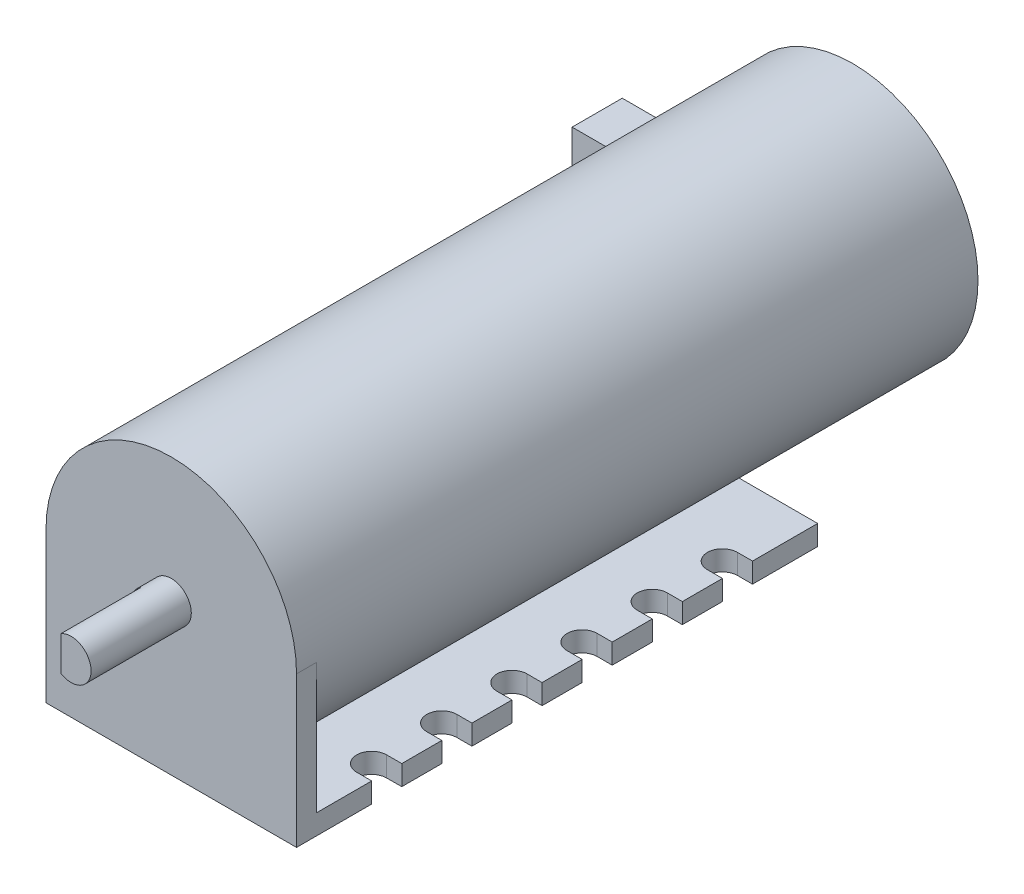
from build123d import *

# Parameters (mm, degrees)
SKETCH1_R           = 12.5
BOSS_EXTRUDE1_DEPTH = 68
SKETCH3_R           = 2
BOSS_EXTRUDE3_DEPTH = 2
BOSS_EXTRUDE2_DEPTH = 8
BOSS_EXTRUDE4_DEPTH = 2
SKETCH5_W           = 25
SKETCH5_H           = 2
BOSS_EXTRUDE5_DEPTH = 50
SKETCH6_R           = 1.5
CUT_EXTRUDE1_DEPTH  = 2
SKETCH7_W           = 5
SKETCH7_H           = 12
BOSS_EXTRUDE6_DEPTH = 15


with BuildPart() as part:
    # Sketch1 → Boss-Extrude1 (new body)
    with BuildSketch(Plane.XY):
        Circle(SKETCH1_R)
    extrude(amount=-BOSS_EXTRUDE1_DEPTH)

    # Sketch3 → Boss-Extrude3 (add)
    with BuildSketch(Plane.XY):
        Circle(SKETCH3_R)
    extrude(amount=BOSS_EXTRUDE3_DEPTH)

    # Sketch2 → Boss-Extrude2 (add)
    with BuildSketch(Plane.XY.offset(2)):
        with BuildLine():
            Line((-1, 1.732050808), (-1, -1.732050808))
            ThreePointArc((-1, -1.732050808), (2, 0), (-1, 1.732050808))
        make_face()
    extrude(amount=BOSS_EXTRUDE2_DEPTH)

    # Sketch4 → Boss-Extrude4 (add)
    with BuildSketch(Plane.XY):
        with BuildLine():
            Line((-12.5, 0), (-12.5, -15))
            Line((-12.5, -15), (12.5, -15))
            Line((12.5, -15), (12.5, 0))
            ThreePointArc((12.5, 0), (0, -12.5), (-12.5, 0))
        make_face()
    extrude(amount=-BOSS_EXTRUDE4_DEPTH)

    # Sketch5 → Boss-Extrude5 (add)
    with BuildSketch(Plane(origin=(0, 0, -2), x_dir=(-1, 0, 0), z_dir=(0, 0, -1))):
        with Locations((0, -14)):
            Rectangle(SKETCH5_W, SKETCH5_H)
    extrude(amount=BOSS_EXTRUDE5_DEPTH)

    # Sketch6 → Cut-Extrude1 (cut)
    with BuildSketch(Plane.XZ.offset(15)):
        with Locations(Location((0, -6, 0), (0, 0, 270))):
            Circle(SKETCH6_R)
        with Locations(Location((0, -12.5, 0), (0, 0, 270))):
            Circle(SKETCH6_R)
        with Locations(Location((0, -19, 0), (0, 0, 270))):
            Circle(SKETCH6_R)
        with Locations(Location((0, -25.5, 0), (0, 0, 270))):
            Circle(SKETCH6_R)
        with Locations(Location((0, -32, 0), (0, 0, 270))):
            Circle(SKETCH6_R)
        with Locations(Location((0, -38.5, 0), (0, 0, 270))):
            Circle(SKETCH6_R)
        with Locations(Location((0, -45, 0), (0, 0, 270))):
            Circle(SKETCH6_R)
        with BuildLine():
            Line((-11, -7.5), (-12.5, -7.5))
            Line((-12.5, -7.5), (-12.5, -10.5))
            Line((-12.5, -10.5), (-11, -10.5))
            ThreePointArc((-11, -10.5), (-9.5, -9), (-11, -7.5))
        make_face()
        with BuildLine():
            Line((-11, -14.5), (-12.5, -14.5))
            Line((-12.5, -14.5), (-12.5, -17.5))
            Line((-12.5, -17.5), (-11, -17.5))
            ThreePointArc((-11, -17.5), (-9.5, -16), (-11, -14.5))
        make_face()
        with BuildLine():
            Line((-11, -21.5), (-12.5, -21.5))
            Line((-12.5, -21.5), (-12.5, -24.5))
            Line((-12.5, -24.5), (-11, -24.5))
            ThreePointArc((-11, -24.5), (-9.5, -23), (-11, -21.5))
        make_face()
        with BuildLine():
            Line((-11, -28.5), (-12.5, -28.5))
            Line((-12.5, -28.5), (-12.5, -31.5))
            Line((-12.5, -31.5), (-11, -31.5))
            ThreePointArc((-11, -31.5), (-9.5, -30), (-11, -28.5))
        make_face()
        with BuildLine():
            Line((-11, -35.5), (-12.5, -35.5))
            Line((-12.5, -35.5), (-12.5, -38.5))
            Line((-12.5, -38.5), (-11, -38.5))
            ThreePointArc((-11, -38.5), (-9.5, -37), (-11, -35.5))
        make_face()
        with BuildLine():
            Line((-11, -42.5), (-12.5, -42.5))
            Line((-12.5, -42.5), (-12.5, -45.5))
            Line((-12.5, -45.5), (-11, -45.5))
            ThreePointArc((-11, -45.5), (-9.5, -44), (-11, -42.5))
        make_face()
        with BuildLine():
            Line((11, -45.5), (12.5, -45.5))
            Line((12.5, -45.5), (12.5, -42.5))
            Line((12.5, -42.5), (11, -42.5))
            ThreePointArc((11, -42.5), (9.5, -44), (11, -45.5))
        make_face()
        with BuildLine():
            Line((11, -38.5), (12.5, -38.5))
            Line((12.5, -38.5), (12.5, -35.5))
            Line((12.5, -35.5), (11, -35.5))
            ThreePointArc((11, -35.5), (9.5, -37), (11, -38.5))
        make_face()
        with BuildLine():
            Line((11, -31.5), (12.5, -31.5))
            Line((12.5, -31.5), (12.5, -28.5))
            Line((12.5, -28.5), (11, -28.5))
            ThreePointArc((11, -28.5), (9.5, -30), (11, -31.5))
        make_face()
        with BuildLine():
            Line((11, -24.5), (12.5, -24.5))
            Line((12.5, -24.5), (12.5, -21.5))
            Line((12.5, -21.5), (11, -21.5))
            ThreePointArc((11, -21.5), (9.5, -23), (11, -24.5))
        make_face()
        with BuildLine():
            Line((11, -17.5), (12.5, -17.5))
            Line((12.5, -17.5), (12.5, -14.5))
            Line((12.5, -14.5), (11, -14.5))
            ThreePointArc((11, -14.5), (9.5, -16), (11, -17.5))
        make_face()
        with BuildLine():
            Line((11, -7.5), (12.5, -7.5))
            Line((12.5, -7.5), (12.5, -10.5))
            Line((12.5, -10.5), (11, -10.5))
            ThreePointArc((11, -10.5), (9.5, -9), (11, -7.5))
        make_face()
    extrude(amount=-CUT_EXTRUDE1_DEPTH, mode=Mode.SUBTRACT)

    # Sketch7 → Boss-Extrude6 (add)
    with BuildSketch(Plane(origin=(0, 0, 0), x_dir=(0, 0, -1), z_dir=(1, 0, 0))):
        with Locations((57.5, 0)):
            Rectangle(SKETCH7_W, SKETCH7_H)
    extrude(amount=-BOSS_EXTRUDE6_DEPTH)


solid = part.part
